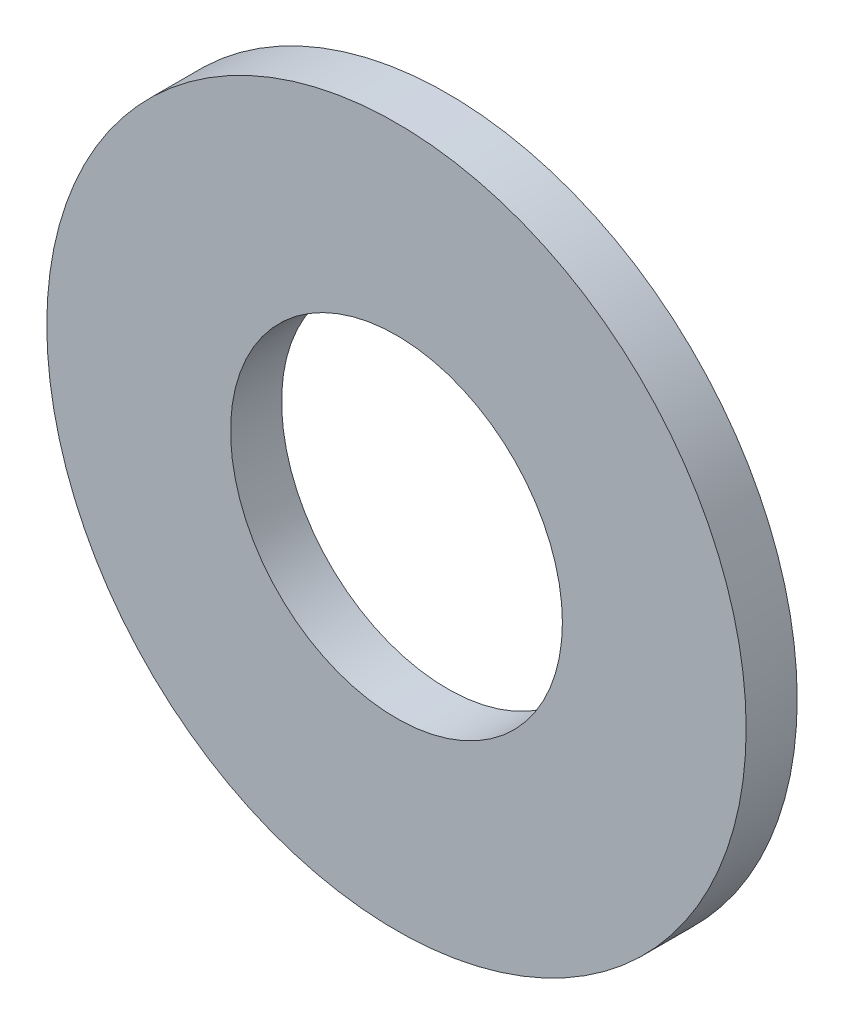
from build123d import *

# Parameters (mm, degrees)
SCHIZZO2_R                   = 3.425
SCHIZZO2_R_2                 = 1.625
ESTRUSIONE_ESTRUSIONE1_DEPTH = 0.5


with BuildPart() as part:
    # Schizzo2 → Estrusione-Estrusione1 (new body)
    with BuildSketch(Plane.XY):
        Circle(SCHIZZO2_R)
        Circle(SCHIZZO2_R_2, mode=Mode.SUBTRACT)
    extrude(amount=ESTRUSIONE_ESTRUSIONE1_DEPTH)


solid = part.part
